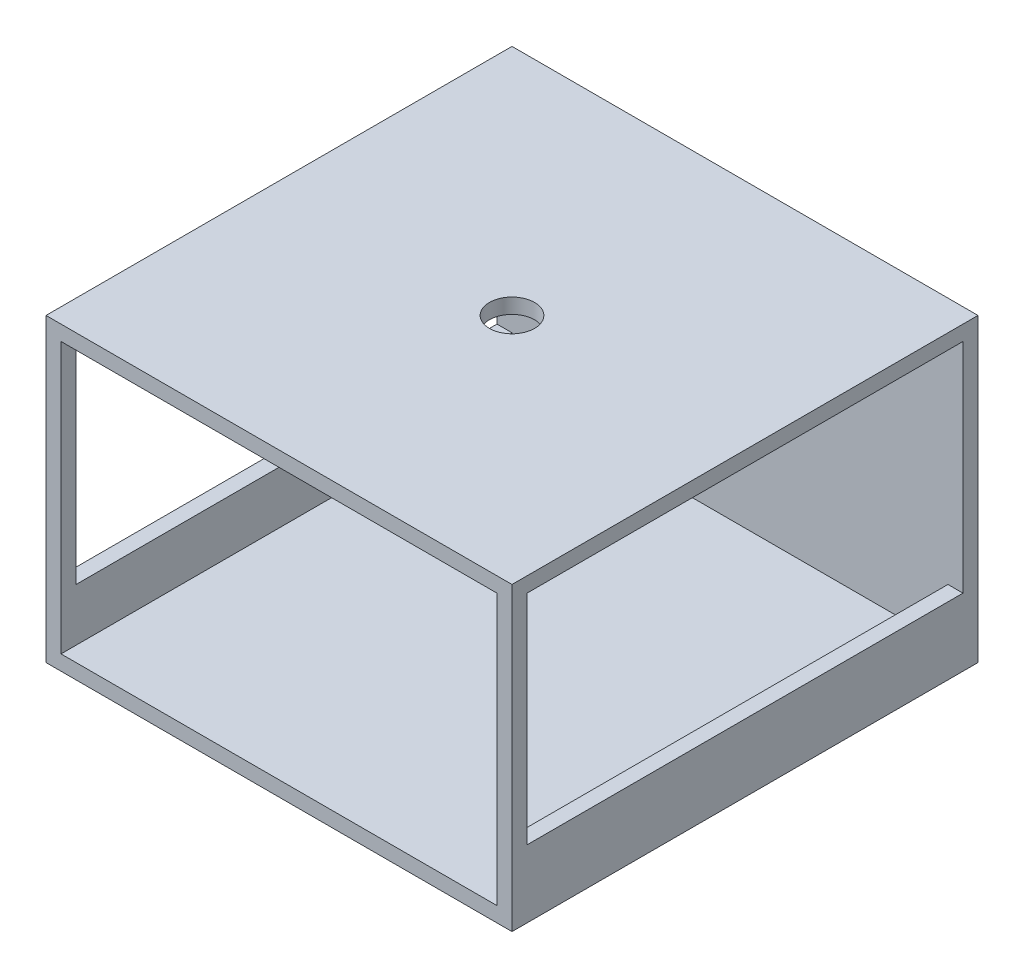
from build123d import *

# Parameters (mm, degrees)
SKETCH1_W           = 155
SKETCH1_H           = 155
BOSS_EXTRUDE1_DEPTH = 100
SHELL1_T            = -5
SKETCH2_R           = 7.5
CUT_EXTRUDE1_DEPTH  = 5
CUT_EXTRUDE2_REACH  = 202.078
SKETCH5_W           = 145
SKETCH5_H           = 72.5


with BuildPart() as part:
    # Sketch1 → Boss-Extrude1 (new body)
    with BuildSketch(Plane(origin=(0, 0, 0), x_dir=(1, 0, 0), z_dir=(0, 1, 0))):
        Rectangle(SKETCH1_W, SKETCH1_H)
    extrude(amount=BOSS_EXTRUDE1_DEPTH)

    # Shell1
    shell1_openings = [part.faces().sort_by_distance(p)[0] for p in [
        (0, 50, 77.5),
    ]]
    offset(amount=SHELL1_T, openings=shell1_openings, kind=Kind.INTERSECTION)

    # Sketch2 → Cut-Extrude1 (cut)
    with BuildSketch(Plane(origin=(0, 100, 0), x_dir=(1, 0, 0), z_dir=(0, 1, 0))):
        with Locations(Location((0, 0, 0), (0, 0, 270))):
            Circle(SKETCH2_R)
    extrude(amount=-CUT_EXTRUDE1_DEPTH, mode=Mode.SUBTRACT)

    # Cut-Extrude2: up to this face of the body (flat: up to its plane)
    cut_extrude2_end = Plane(part.part.faces().sort_by_distance((77.5, 50, 0))[0])
    # Sketch5 → Cut-Extrude2 (cut, up to the picked face)
    with BuildSketch(Plane.ZY.offset(77.5), mode=Mode.PRIVATE) as cut_extrude2_sk1:
        with Locations((0, 58.75)):
            Rectangle(SKETCH5_W, SKETCH5_H)
    cut_extrude2_tool1 = split(extrude(cut_extrude2_sk1.sketch, amount=-CUT_EXTRUDE2_REACH, mode=Mode.PRIVATE), bisect_by=cut_extrude2_end, keep=Keep.BOTH, mode=Mode.PRIVATE)
    add(cut_extrude2_tool1.solids().sort_by(Axis((-77.5, 58.75, 0), (1, 0, 0)))[0], mode=Mode.SUBTRACT)


solid = part.part
